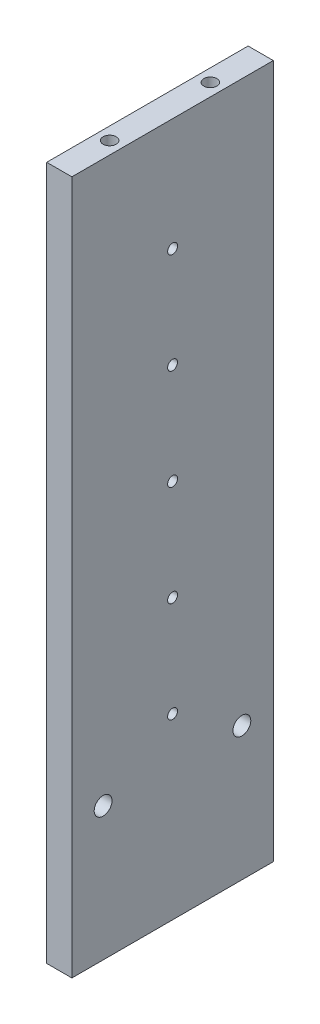
from build123d import *

# Parameters (mm, degrees)
SKETCH1_W                 = 6.35
SKETCH1_H                 = 38.1
BOSS_EXTRUDE1_DEPTH       = 175
M4X0_7_TAPPED_HOLE1_D     = 3.3
M4X0_7_TAPPED_HOLE1_DEPTH = 10.1
M4X0_7_TAPPED_HOLE1_TIP   = 0.991420021
M3X0_5_TAPPED_HOLE1_D     = 2.5
SKETCH9_W                 = 6.35
SKETCH9_H                 = 175
BOSS_EXTRUDE2_DEPTH       = 6.35
SKETCH8_R                 = 2.25
CUT_EXTRUDE1_DEPTH        = 181.668550113
M4X0_7_TAPPED_HOLE2_D     = 3.3
M4X0_7_TAPPED_HOLE2_DEPTH = 25.4
M4X0_7_TAPPED_HOLE2_TIP   = 0.991420021


with BuildPart() as part:
    # Sketch1 → Boss-Extrude1 (new body)
    with BuildSketch(Plane(origin=(0, 0, 0), x_dir=(1, 0, 0), z_dir=(0, 1, 0))):
        with Locations((3.175, 19.05)):
            Rectangle(SKETCH1_W, SKETCH1_H)
    extrude(amount=BOSS_EXTRUDE1_DEPTH)

    # M4x0.7 Tapped Hole1
    with Locations(Plane(origin=(0, 175, 0), x_dir=(1, 0, 0), z_dir=(0, 1, 0))):
        with Locations((3.175, 31.75), (3.175, 6.35)):
            Hole(M4X0_7_TAPPED_HOLE1_D / 2, depth=M4X0_7_TAPPED_HOLE1_DEPTH)
            with Locations((0, 0, -(M4X0_7_TAPPED_HOLE1_DEPTH + M4X0_7_TAPPED_HOLE1_TIP / 2))):  # 118° drill point
                Cone(0, M4X0_7_TAPPED_HOLE1_D / 2, M4X0_7_TAPPED_HOLE1_TIP, mode=Mode.SUBTRACT)

    # M3x0.5 Tapped Hole1 (through all)
    with Locations(Plane(origin=(6.35, 0, 0), x_dir=(0, 0, -1), z_dir=(1, 0, 0))):
        with Locations((19.05, 121.2), (19.05, 95.8), (19.05, 70.4), (19.05, 45), (19.05, 146.6)):
            Hole(M3X0_5_TAPPED_HOLE1_D / 2)

    # Sketch9 → Boss-Extrude2 (add)
    with BuildSketch(Plane(origin=(6.35, 0, 0), x_dir=(0, 0, -1), z_dir=(1, 0, 0))):
        with Locations((-3.175, 87.5)):
            Rectangle(SKETCH9_W, SKETCH9_H)
        with Locations((41.275, 87.5)):
            Rectangle(SKETCH9_W, SKETCH9_H)
    extrude(amount=-BOSS_EXTRUDE2_DEPTH)

    # Sketch8 → Cut-Extrude1 (cut, through all)
    with BuildSketch(Plane(origin=(6.35, 0, 0), x_dir=(0, 0, -1), z_dir=(1, 0, 0))):
        with Locations((36.524, 33.675)):
            Circle(SKETCH8_R)
        with Locations((1.524, 33.675)):
            Circle(SKETCH8_R)
    extrude(amount=-CUT_EXTRUDE1_DEPTH, mode=Mode.SUBTRACT)

    # M4x0.7 Tapped Hole2
    with Locations(Plane(origin=(0, 0, 0), x_dir=(-1, 0, 0), z_dir=(0, -1, 0))):
        with Locations((-3.175, 6.35), (-3.175, 31.75)):
            Hole(M4X0_7_TAPPED_HOLE2_D / 2, depth=M4X0_7_TAPPED_HOLE2_DEPTH)
            with Locations((0, 0, -(M4X0_7_TAPPED_HOLE2_DEPTH + M4X0_7_TAPPED_HOLE2_TIP / 2))):  # 118° drill point
                Cone(0, M4X0_7_TAPPED_HOLE2_D / 2, M4X0_7_TAPPED_HOLE2_TIP, mode=Mode.SUBTRACT)


solid = part.part
